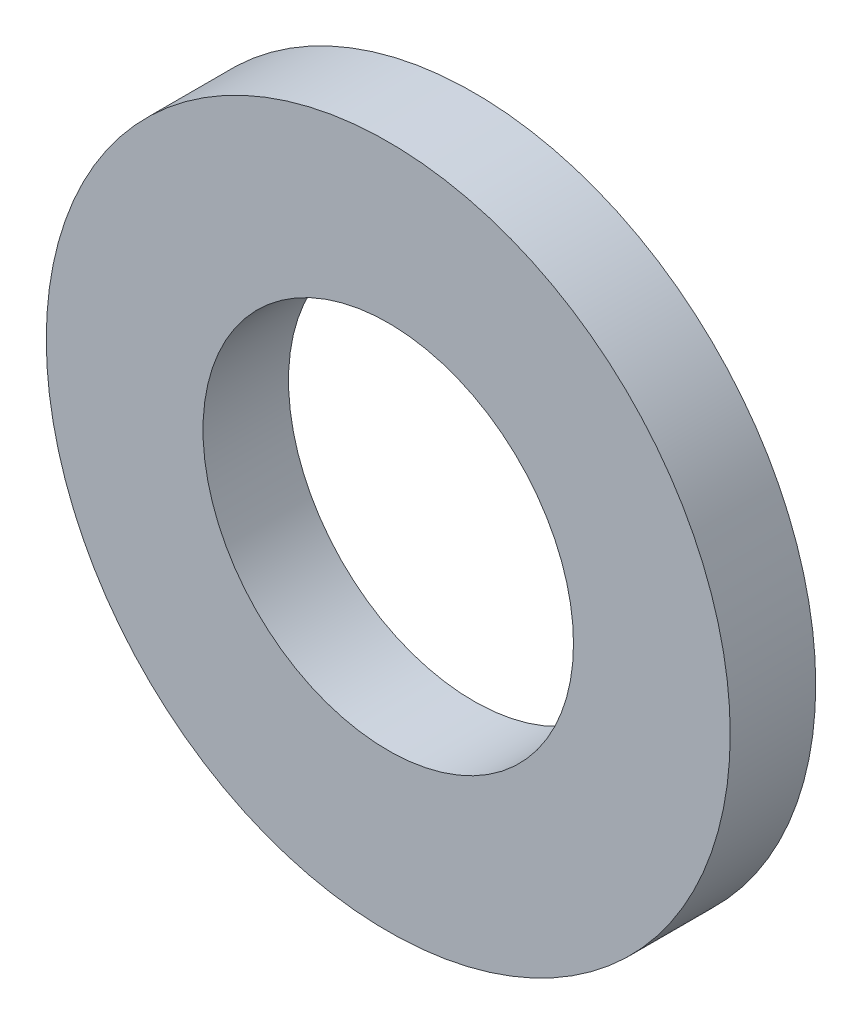
from build123d import *

# Parameters (mm, degrees)
SKETCH_1_R          = 12
EXTRUDE_1_DEPTH     = 3
SKETCH_3_R          = 6.5
CUT_EXTRUDE_1_DEPTH = 3


with BuildPart() as part:
    # 草图1 → 凸台-拉伸1 (new body)
    with BuildSketch(Plane.XY):
        Circle(SKETCH_1_R)
    extrude(amount=EXTRUDE_1_DEPTH)

    # 草图3 → 切除-拉伸1 (cut)
    with BuildSketch(Plane.XY.offset(3)):
        Circle(SKETCH_3_R)
    extrude(amount=-CUT_EXTRUDE_1_DEPTH, mode=Mode.SUBTRACT)


solid = part.part
